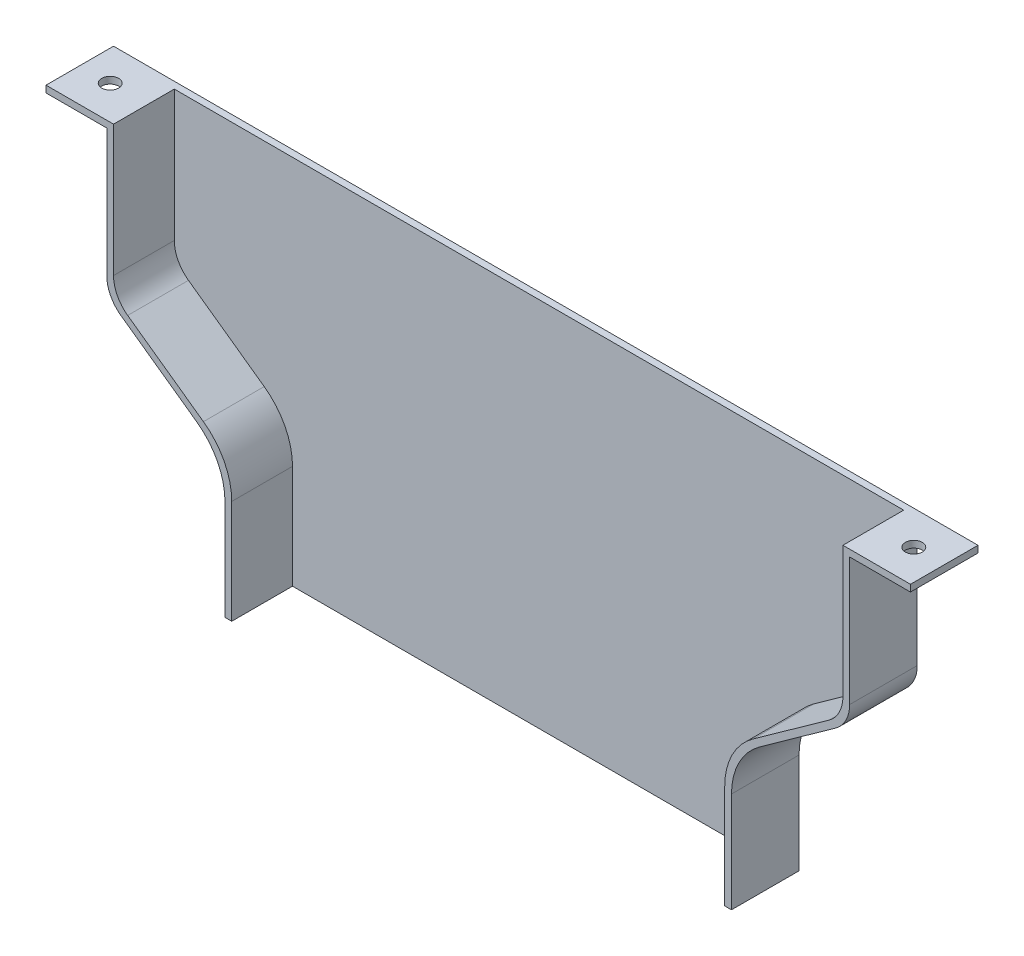
from build123d import *

# Parameters (mm, degrees)
BOSS_EXTRU_1_DEPTH      = 20
ENL_V_MAT_EXTRU_2_DEPTH = 18
CONG_1_R                = 20
CONG_2_R                = 10
ESQUISSE7_W             = 20
ESQUISSE7_H             = 20
BOSS_EXTRU_2_DEPTH      = 2
ESQUISSE8_R             = 2.5
ENL_V_MAT_EXTRU_3_DEPTH = 10


with BuildPart() as part:
    # Esquisse1 → Boss.-Extru.1 (new body)
    with BuildSketch(Plane.XY):
        Polygon((110, 110), (-110, 110), (-110, 65), (-75, 40), (-75, 0), (75, 0), (75, 40), (110, 65), align=None)
    extrude(amount=BOSS_EXTRU_1_DEPTH)

    # Esquisse4 → Enlèv. mat.-Extru.2 (cut)
    with BuildSketch(Plane.XY.offset(20)):
        Polygon((-108, 181.485608489), (-108, 66.029235791), (-73, 41.029235791), (-73, -7.129747867), (73, -7.129747867), (73, 41.029235791), (108, 66.029235791), (108, 181.485608489), align=None)
    extrude(amount=-ENL_V_MAT_EXTRU_2_DEPTH, mode=Mode.SUBTRACT)

    # Congé1
    cong_1_edges = [part.edges().sort_by_distance(p)[0] for p in [
        (75, 40, 10),
        (-75, 40, 10),
        (73, 41.029235791, 11),
        (-73, 41.029235791, 11),
    ]]
    fillet(cong_1_edges, radius=CONG_1_R)

    # Congé2
    cong_2_edges = [part.edges().sort_by_distance(p)[0] for p in [
        (110, 65, 10),
        (-110, 65, 10),
        (-108, 66.029235791, 11),
        (108, 66.029235791, 11),
    ]]
    fillet(cong_2_edges, radius=CONG_2_R)

    # Esquisse7 → Boss.-Extru.2 (add)
    with BuildSketch(Plane(origin=(0, 110, 0), x_dir=(1, 0, 0), z_dir=(0, 1, 0))):
        with Locations((-118, -10)):
            Rectangle(ESQUISSE7_W, ESQUISSE7_H)
        with Locations((118, -10)):
            Rectangle(ESQUISSE7_W, ESQUISSE7_H)
    extrude(amount=-BOSS_EXTRU_2_DEPTH)

    # Esquisse8 → Enlèv. mat.-Extru.3 (cut)
    with BuildSketch(Plane.XZ.offset(-108)):
        with Locations(Location((119, 10, 0), (0, 0, 270))):
            Circle(ESQUISSE8_R)
        with Locations((-119, 10)):
            Circle(ESQUISSE8_R)
    extrude(amount=-ENL_V_MAT_EXTRU_3_DEPTH, mode=Mode.SUBTRACT)


solid = part.part
